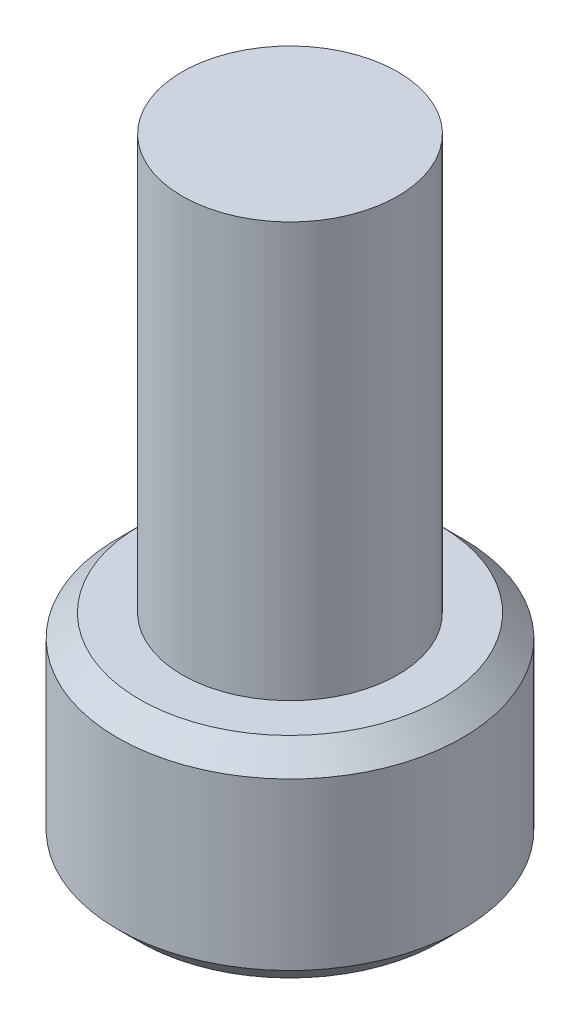
from build123d import *

# Parameters (mm, degrees)
SKETCH1_R           = 2.4765
BOSS_EXTRUDE1_DEPTH = 9.525
SKETCH2_R           = 3.9624
BOSS_EXTRUDE2_DEPTH = 4.826
CUT_EXTRUDE1_DEPTH  = 2.286
CHAMFER1_SIZE       = 0.508


with BuildPart() as part:
    # Sketch1 → Boss-Extrude1 (new body)
    with BuildSketch(Plane(origin=(0, 0, 0), x_dir=(1, 0, 0), z_dir=(0, 1, 0))):
        with Locations(Location((0, 0, 0), (0, 0, 90))):
            Circle(SKETCH1_R)
    extrude(amount=BOSS_EXTRUDE1_DEPTH)

    # Sketch2 → Boss-Extrude2 (add)
    with BuildSketch(Plane.XZ):
        with Locations(Location((0, 0, 0), (0, 0, 270))):
            Circle(SKETCH2_R)
    extrude(amount=BOSS_EXTRUDE2_DEPTH)

    # Sketch3 → Cut-Extrude1 (cut)
    with BuildSketch(Plane.XZ.offset(4.826)):
        Polygon((2.291358881, 0), (1.14567944, 1.984375), (-1.14567944, 1.984375), (-2.291358881, 0), (-1.14567944, -1.984375), (1.14567944, -1.984375), align=None)
    extrude(amount=-CUT_EXTRUDE1_DEPTH, mode=Mode.SUBTRACT)

    # Chamfer1
    chamfer1_edges = [part.edges().sort_by_distance(p)[0] for p in [
        (0, 0, 3.9624),
        (0, -4.826, 3.9624),
    ]]
    chamfer(chamfer1_edges, length=CHAMFER1_SIZE)


solid = part.part
